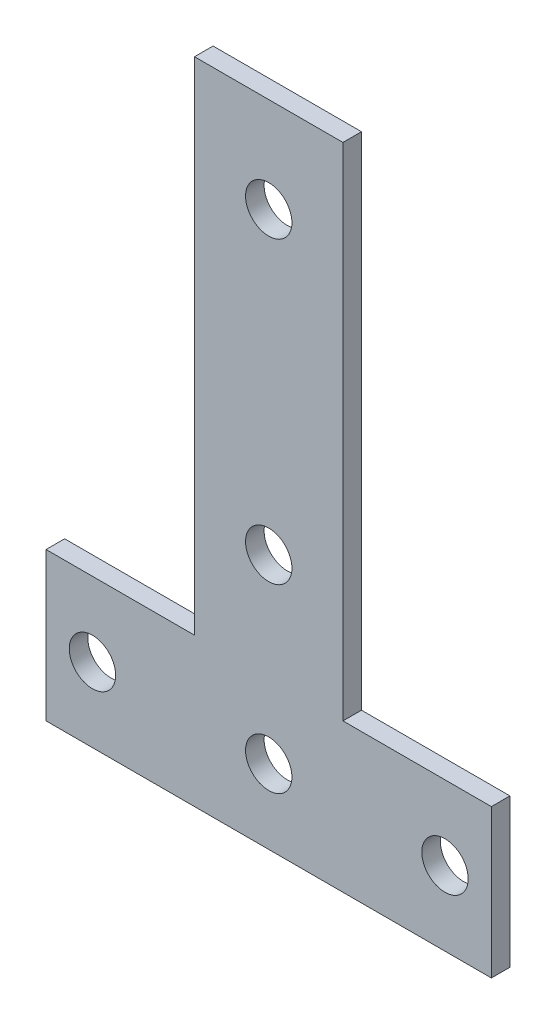
from build123d import *

# Parameters (mm, degrees)
SKETCH2_R      = 2.5
EXTRUDE1_DEPTH = 2


with BuildPart() as part:
    # Sketch2 → Extrude1 (new body)
    with BuildSketch(Plane.XY):
        Polygon((-8, 0), (-8, 54), (8, 54), (8, 0), (24, 0), (24, -16), (-24, -16), (-24, 0), align=None)
        with Locations((19, -8)):
            Circle(SKETCH2_R, mode=Mode.SUBTRACT)
        with Locations((0, -8)):
            Circle(SKETCH2_R, mode=Mode.SUBTRACT)
        with Locations((-19, -8)):
            Circle(SKETCH2_R, mode=Mode.SUBTRACT)
        with Locations((0, 43.75)):
            Circle(SKETCH2_R, mode=Mode.SUBTRACT)
        with Locations((0, 11.5)):
            Circle(SKETCH2_R, mode=Mode.SUBTRACT)
    extrude(amount=EXTRUDE1_DEPTH)


solid = part.part
